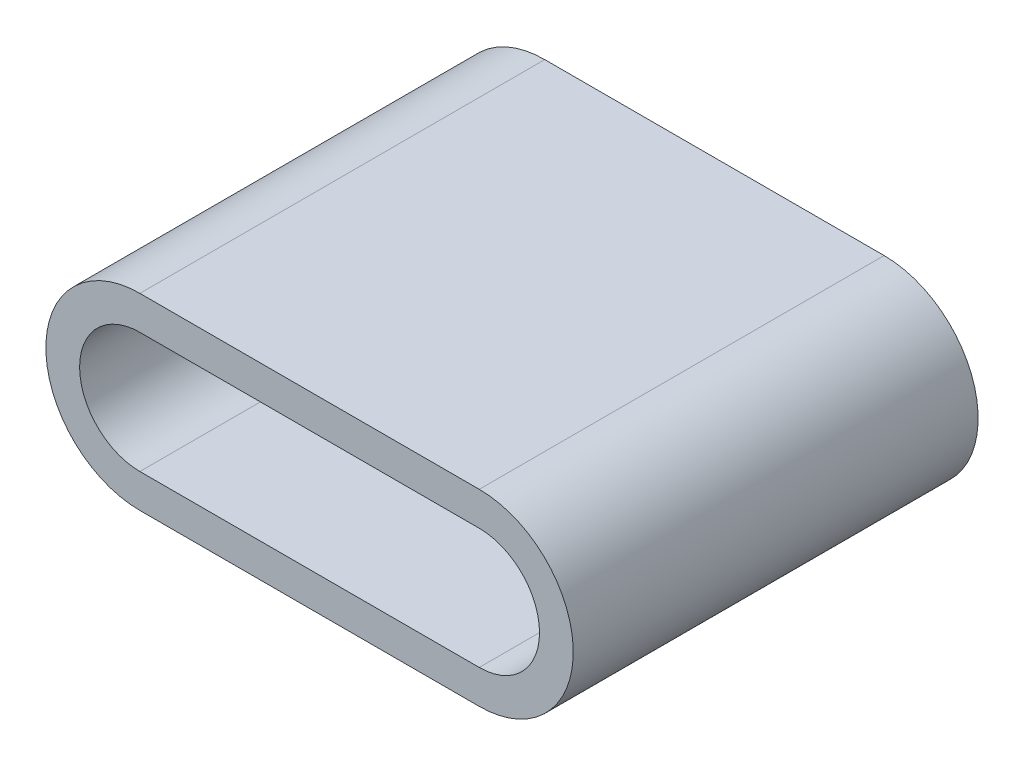
from build123d import *

# Parameters (mm, degrees)
EXTRUDE_1_DEPTH      = 10
EXTRUDE_1_DEPTH_BACK = 20
EXTRUDE_1_2_DEPTH    = 30


with BuildPart() as part:
    # 草图1 → Extrude 1 (new, two sides: drawn at the far end of the back side and taken through both)
    with BuildSketch(Plane.XY.offset(-EXTRUDE_1_DEPTH_BACK)):
        with BuildLine():
            Line((0, 13.930688276), (50.29066082, 13.930688276))
            ThreePointArc((50.29066082, 13.930688276), (64.221349097, 0), (50.29066082, -13.930688276))
            Line((50.29066082, -13.930688276), (0, -13.930688276))
            ThreePointArc((0, -13.930688276), (-13.930688276, 0), (0, 13.930688276))
        make_face()
    extrude(amount=EXTRUDE_1_DEPTH + EXTRUDE_1_DEPTH_BACK)

    # 草图7 → Extrude 1 2 (add)
    with BuildSketch(Plane.XY.offset(10)):
        with BuildLine():
            Line((50.29066082, 13.930688276), (0, 13.930688276))
            ThreePointArc((0, 13.930688276), (-13.930688276, 0), (0, -13.930688276))
            Line((0, -13.930688276), (50.29066082, -13.930688276))
            ThreePointArc((50.29066082, -13.930688276), (64.221349097, 0), (50.29066082, 13.930688276))
        make_face()
        with BuildLine():
            Line((50.29066082, 8.930688276), (0, 8.930688276))
            ThreePointArc((0, 8.930688276), (-8.930688276, 0), (0, -8.930688276))
            Line((0, -8.930688276), (50.29066082, -8.930688276))
            ThreePointArc((50.29066082, -8.930688276), (59.221349097, 0), (50.29066082, 8.930688276))
        make_face(mode=Mode.SUBTRACT)
    extrude(amount=EXTRUDE_1_2_DEPTH)


solid = part.part
